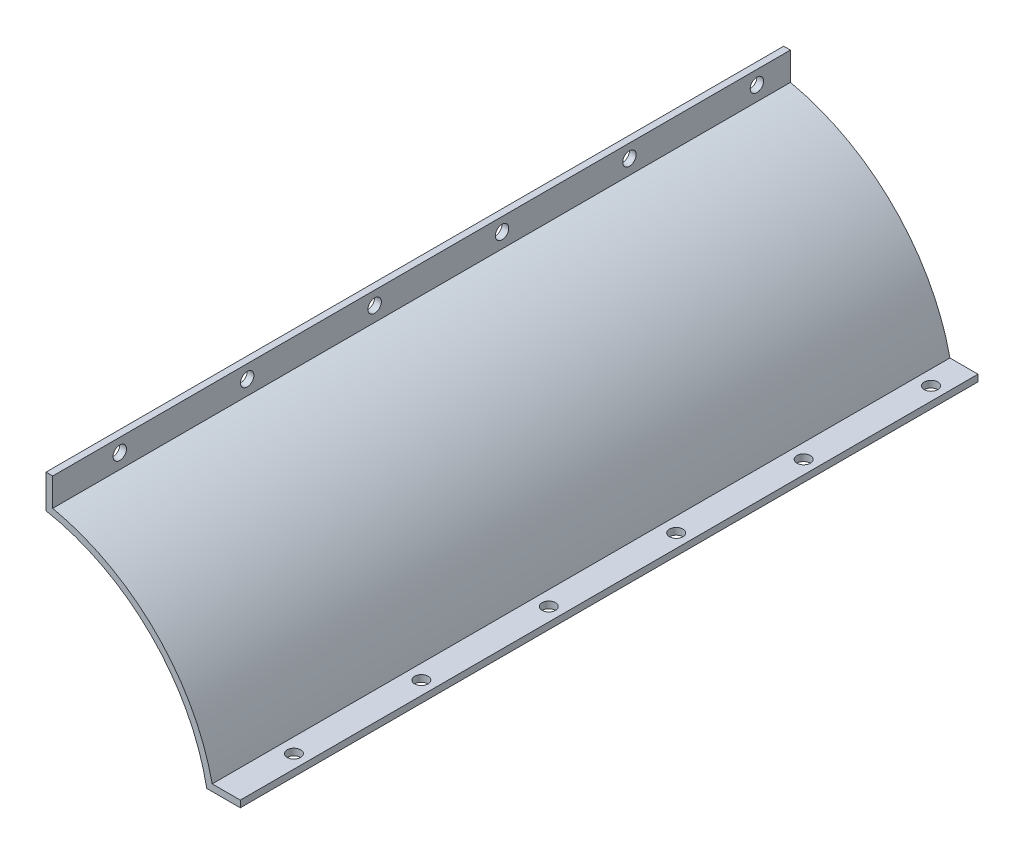
from build123d import *

# Parameters (mm, degrees)
BOSS_EXTRUDE1_DEPTH = 279.4
SKETCH3_R           = 2.54
CUT_EXTRUDE1_DEPTH  = 279.4
SKETCH4_R           = 2.54
CUT_EXTRUDE2_DEPTH  = 279.4


with BuildPart() as part:
    # Sketch2 → Boss-Extrude1 (new body)
    with BuildSketch(Plane.XY):
        with BuildLine():
            Line((76.923497933, 16.815560225), (87.550840879, 16.815560225))
            Line((87.550840879, 16.815560225), (87.550840879, 14.275560225))
            Line((87.550840879, 14.275560225), (74.850840879, 14.275560225))
            ThreePointArc((74.850840879, 14.275560225), (53.771488035, 53.99136111), (13.97, 74.908471484))
            Line((13.97, 74.908471484), (13.97, 87.608471484))
            Line((13.97, 87.608471484), (16.51, 87.608471484))
            Line((16.51, 87.608471484), (16.51, 76.989658396))
            ThreePointArc((16.51, 76.989658396), (55.566943021, 55.788013437), (76.923497933, 16.815560225))
        make_face()
    extrude(amount=BOSS_EXTRUDE1_DEPTH)

    # Sketch3 → Cut-Extrude1 (cut)
    with BuildSketch(Plane(origin=(16.51, 0, 0), x_dir=(0, 0, -1), z_dir=(1, 0, 0))):
        with Locations((-12.7, 82.528471484)):
            Circle(SKETCH3_R)
        with Locations((-60.96, 82.528471484)):
            Circle(SKETCH3_R)
        with Locations((-109.22, 82.528471484)):
            Circle(SKETCH3_R)
        with Locations((-157.48, 82.528471484)):
            Circle(SKETCH3_R)
        with Locations((-205.74, 82.528471484)):
            Circle(SKETCH3_R)
        with Locations((-254, 82.528471484)):
            Circle(SKETCH3_R)
    extrude(amount=-CUT_EXTRUDE1_DEPTH, mode=Mode.SUBTRACT)

    # Sketch4 → Cut-Extrude2 (cut)
    with BuildSketch(Plane.XZ.offset(-14.275560225)):
        with Locations((82.470840879, 12.7)):
            Circle(SKETCH4_R)
        with Locations((82.470840879, 60.96)):
            Circle(SKETCH4_R)
        with Locations((82.470840879, 109.22)):
            Circle(SKETCH4_R)
        with Locations((82.470840879, 157.48)):
            Circle(SKETCH4_R)
        with Locations((82.470840879, 205.74)):
            Circle(SKETCH4_R)
        with Locations((82.470840879, 254)):
            Circle(SKETCH4_R)
    extrude(amount=-CUT_EXTRUDE2_DEPTH, mode=Mode.SUBTRACT)


solid = part.part
